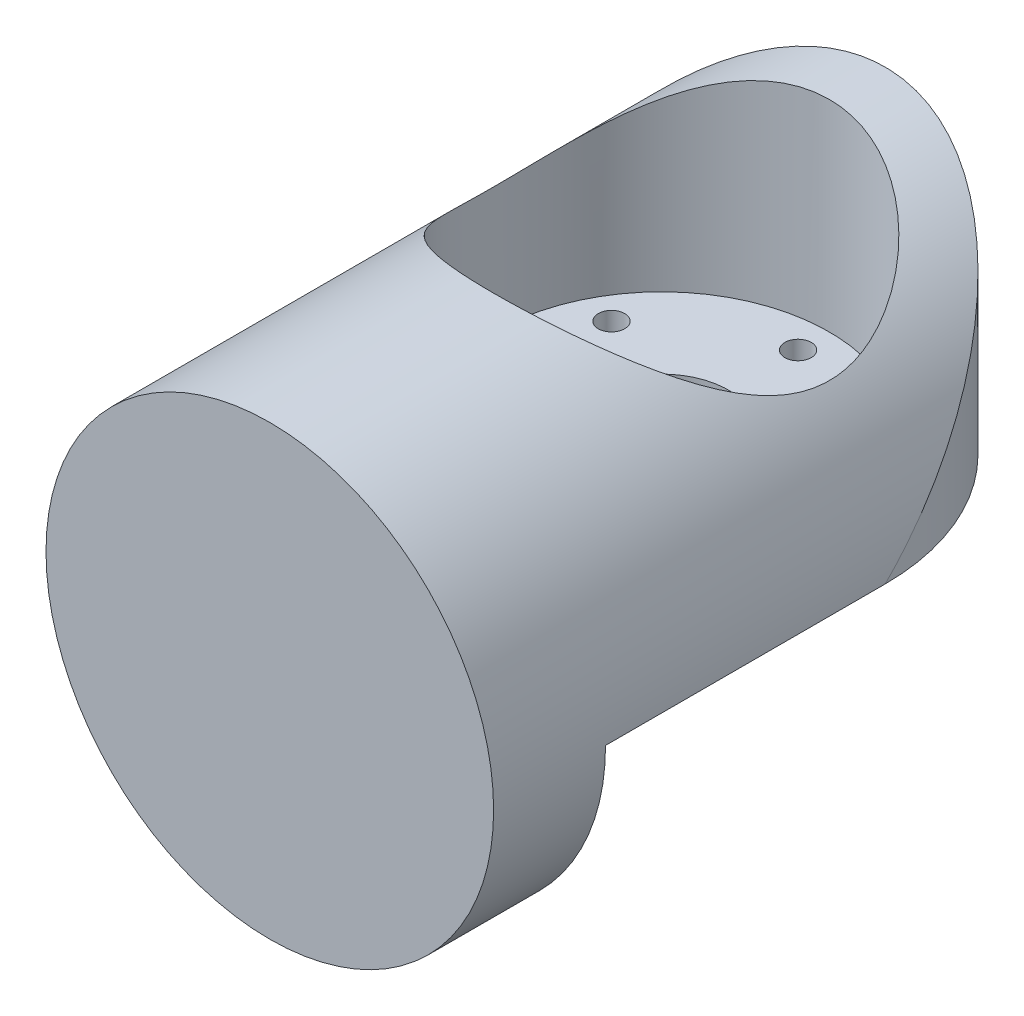
from build123d import *

# Parameters (mm, degrees)
SKETCH1_R           = 25.4
BOSS_EXTRUDE1_DEPTH = 12.7
SKETCH2_R           = 25.4
SKETCH2_W           = 50.8
SKETCH2_H           = 31.75
BOSS_EXTRUDE2_DEPTH = 25.4
SKETCH4_R           = 19.05
CUT_EXTRUDE2_DEPTH  = 22.86
CUT_EXTRUDE1_DEPTH  = 68.501425911
SKETCH5_R           = 7.62
SKETCH5_R_2         = 1.5
CUT_EXTRUDE3_DEPTH  = 69.497635846


with BuildPart() as part:
    # Sketch1 → Boss-Extrude1 (new body)
    with BuildSketch(Plane.XY):
        Circle(SKETCH1_R)
    extrude(amount=BOSS_EXTRUDE1_DEPTH)

    # Sketch2 → Boss-Extrude2 (add)
    with BuildSketch(Plane(origin=(0, 0, 0), x_dir=(1, 0, 0), z_dir=(0, 1, 0))):
        with Locations((0, 31.75)):
            Circle(SKETCH2_R)
        with Locations((0, 15.875)):
            Rectangle(SKETCH2_W, SKETCH2_H)
    extrude(amount=BOSS_EXTRUDE2_DEPTH)

    # Sketch4 → Cut-Extrude2 (cut)
    with BuildSketch(Plane.XZ.offset(-25.4)):
        with Locations(Location((0, -31.75, 0), (0, 0, 90))):
            Circle(SKETCH4_R)
    extrude(amount=CUT_EXTRUDE2_DEPTH, mode=Mode.SUBTRACT)

    # Sketch3 → Cut-Extrude1 (cut, through all)
    with BuildSketch(Plane.XY):
        with BuildLine():
            ThreePointArc((0, 25.4), (17.960512242, 17.960512242), (25.4, 0))
            Line((25.4, 0), (25.4, 25.4))
            Line((25.4, 25.4), (0, 25.4))
        make_face()
        with BuildLine():
            ThreePointArc((-25.4, 0), (-17.960512242, 17.960512242), (0, 25.4))
            Line((0, 25.4), (-25.4, 25.4))
            Line((-25.4, 25.4), (-25.4, 0))
        make_face()
    extrude(amount=-CUT_EXTRUDE1_DEPTH, mode=Mode.SUBTRACT)

    # Sketch5 → Cut-Extrude3 (cut, through all)
    with BuildSketch(Plane(origin=(0, 2.54, 0), x_dir=(1, 0, 0), z_dir=(0, 1, 0))):
        with Locations(Location((0, 31.75, 0), (0, 0, 270))):
            Circle(SKETCH5_R)
        with Locations(Location((0, 47.249999988, 0), (0, 0, 270))):
            Circle(SKETCH5_R_2)
        with Locations(Location((13.423393748, 39.499999994, 0), (0, 0, 270))):
            Circle(SKETCH5_R_2)
        with Locations(Location((13.423393748, 24.000000006, 0), (0, 0, 270))):
            Circle(SKETCH5_R_2)
        with Locations(Location((0, 16.250000012, 0), (0, 0, 270))):
            Circle(SKETCH5_R_2)
        with Locations(Location((-13.423393748, 24.000000006, 0), (0, 0, 270))):
            Circle(SKETCH5_R_2)
        with Locations(Location((-13.423393748, 39.499999994, 0), (0, 0, 270))):
            Circle(SKETCH5_R_2)
    extrude(amount=-CUT_EXTRUDE3_DEPTH, mode=Mode.SUBTRACT)


solid = part.part
